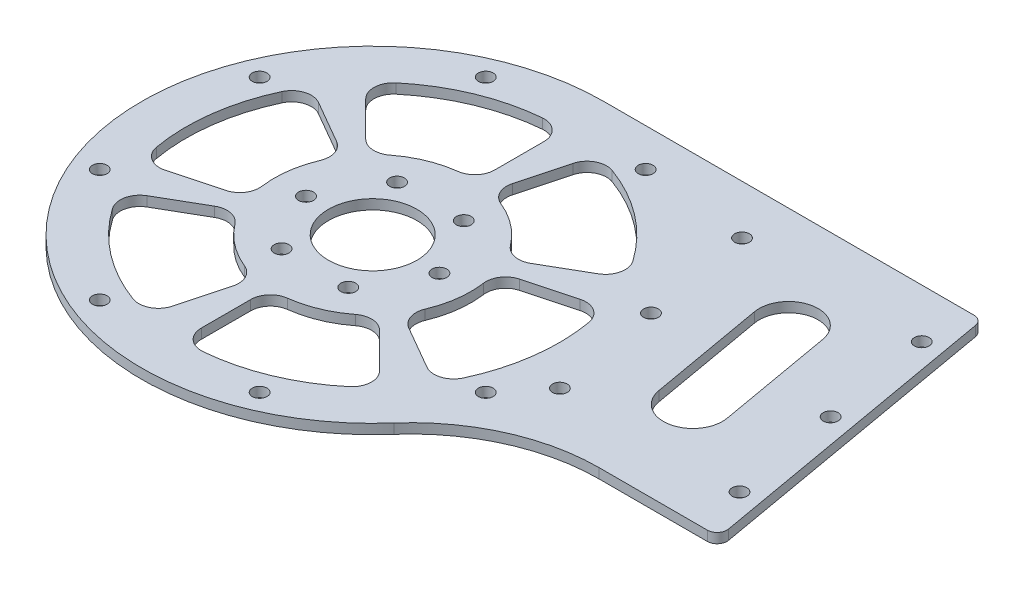
from build123d import *

# Parameters (mm, degrees)
SKETCH_1_R               = 1.5
SKETCH_1_R_2             = 9
EXTRUDE_1_DEPTH          = 2
CUT_EXTRUDE_1_DEPTH      = 100.85333965
CUT_EXTRUDE_1_DEPTH_BACK = 100.85333965
SKETCH_2_R               = 1.5
CUT_EXTRUDE_2_DEPTH      = 100.85333965
CUT_EXTRUDE_2_DEPTH_BACK = 100.85333965


with BuildPart() as part:
    # 草图1 → 凸台-拉伸1 (new body)
    with BuildSketch(Plane(origin=(0, 0, 0), x_dir=(1, 0, 0), z_dir=(0, 1, 0))):
        with BuildLine():
            Line((0, 47), (75.321800738, 47))
            ThreePointArc((75.321800738, 47), (76.607375957, 46.532088886), (77.291416244, 45.347296355))
            Line((77.291416244, 45.347296355), (88.047362067, -15.652703645))
            ThreePointArc((88.047362067, -15.652703645), (87.609835447, -17.285575219), (86.077746561, -18))
            Line((86.077746561, -18), (64.077746561, -18))
            ThreePointArc((64.077746561, -18), (48.289235397, -21.406433974), (35.309770387, -31.019673035))
            ThreePointArc((35.309770387, -31.019673035), (-42.818948099, -19.378794691), (0, 47))
        make_face()
        with Locations(Location((-16.264045876, 39.264880132, 0), (0, 0, 270))):
            Circle(SKETCH_1_R, mode=Mode.SUBTRACT)
        with Locations(Location((16.264045876, 39.264880132, 0), (0, 0, 270))):
            Circle(SKETCH_1_R, mode=Mode.SUBTRACT)
        with Locations(Location((39.264880132, -16.264045876, 0), (0, 0, 270))):
            Circle(SKETCH_1_R, mode=Mode.SUBTRACT)
        with Locations(Location((16.264045876, -39.264880132, 0), (0, 0, 270))):
            Circle(SKETCH_1_R, mode=Mode.SUBTRACT)
        with Locations(Location((-16.264045876, -39.264880132, 0), (0, 0, 270))):
            Circle(SKETCH_1_R, mode=Mode.SUBTRACT)
        with Locations(Location((-39.264880132, -16.264045876, 0), (0, 0, 270))):
            Circle(SKETCH_1_R, mode=Mode.SUBTRACT)
        with Locations(Location((-39.264880132, 16.264045876, 0), (0, 0, 270))):
            Circle(SKETCH_1_R, mode=Mode.SUBTRACT)
        with Locations(Location((0, 0, 0), (0, 0, 270))):
            Circle(SKETCH_1_R_2, mode=Mode.SUBTRACT)
        with Locations(Location((-6.783865663, 11.75, 0), (0, 0, 270))):
            Circle(SKETCH_1_R, mode=Mode.SUBTRACT)
        with Locations(Location((6.783865663, 11.75, 0), (0, 0, 270))):
            Circle(SKETCH_1_R, mode=Mode.SUBTRACT)
        with Locations(Location((13.567731326, 0, 0), (0, 0, 270))):
            Circle(SKETCH_1_R, mode=Mode.SUBTRACT)
        with Locations(Location((6.783865663, -11.75, 0), (0, 0, 270))):
            Circle(SKETCH_1_R, mode=Mode.SUBTRACT)
        with Locations(Location((-6.783865663, -11.75, 0), (0, 0, 270))):
            Circle(SKETCH_1_R, mode=Mode.SUBTRACT)
        with Locations(Location((-13.567731326, 0, 0), (0, 0, 270))):
            Circle(SKETCH_1_R, mode=Mode.SUBTRACT)
    extrude(amount=EXTRUDE_1_DEPTH)

    # 草图2 → 切除-拉伸1 (cut, two sides: drawn at the far end of the back side and taken through both)
    with BuildSketch(Plane(origin=(0, 2, 0), x_dir=(1, 0, 0), z_dir=(0, 1, 0)).offset(-CUT_EXTRUDE_1_DEPTH_BACK)):
        with Locations(Location((74.70156336, 37, 0), (0, 0, 270))):
            Circle(SKETCH_2_R)
        with Locations(Location((78.668920425, 14.5, 0), (0, 0, 270))):
            Circle(SKETCH_2_R)
        with Locations(Location((82.636277491, -8, 0), (0, 0, 270))):
            Circle(SKETCH_2_R)
        with Locations(Location((38.146205332, 37, 0), (0, 0, 270))):
            Circle(SKETCH_2_R)
        with Locations(Location((46.080919464, -8, 0), (0, 0, 270))):
            Circle(SKETCH_2_R)
        with Locations(Location((42.113562398, 14.5, 0), (0, 0, 270))):
            Circle(SKETCH_2_R)
        with BuildLine():
            Line((64.216309798, 27.359582102), (68.383866062, 3.72419603))
            ThreePointArc((68.383866062, 3.72419603), (63.51690861, -3.226539554), (56.566173025, 1.640417898))
            Line((56.566173025, 1.640417898), (52.398616761, 25.27580397))
            ThreePointArc((52.398616761, 25.27580397), (57.265574214, 32.226539554), (64.216309798, 27.359582102))
        make_face()
    extrude(amount=CUT_EXTRUDE_1_DEPTH + CUT_EXTRUDE_1_DEPTH_BACK, mode=Mode.SUBTRACT)

    # 草图3 → 切除-拉伸2 (cut, two sides: drawn at the far end of the back side and taken through both)
    with BuildSketch(Plane.XZ.offset(-CUT_EXTRUDE_2_DEPTH_BACK)):
        with BuildLine():
            ThreePointArc((13.035455865, -35.694213682), (23.132934302, -30.147426931), (31.104138605, -21.829625778))
            ThreePointArc((31.104138605, -21.829625778), (31.73567133, -18.668128181), (29.830018752, -16.067668818))
            Line((29.830018752, -16.067668818), (21.121590627, -11.039855496))
            ThreePointArc((21.121590627, -11.039855496), (18.33030278, -10.583005244), (15.934658856, -12.086630926))
            ThreePointArc((15.934658856, -12.086630926), (12.17522858, -15.867066806), (7.550595775, -18.519948797))
            ThreePointArc((7.550595775, -18.519948797), (5.478166623, -20.44479617), (5.197011625, -23.259214737))
            Line((5.197011625, -23.259214737), (7.799599311, -32.972204212))
            ThreePointArc((7.799599311, -32.972204212), (9.818230989, -35.485971662), (13.035455865, -35.694213682))
        make_face()
        with BuildLine():
            ThreePointArc((37.429823749, -6.558070912), (37.674904732, 4.959995304), (34.457079782, 16.022161306))
            ThreePointArc((34.457079782, 16.022161306), (32.03490891, 18.149833488), (28.830018752, 17.799719626))
            Line((28.830018752, 17.799719626), (20.121590627, 12.771906304))
            ThreePointArc((20.121590627, 12.771906304), (18.33030278, 10.583005244), (18.434658856, 7.756503907))
            ThreePointArc((18.434658856, 7.756503907), (19.828897227, 2.610523844), (19.814044022, -2.720966644))
            ThreePointArc((19.814044022, -2.720966644), (20.44479617, -5.478166623), (22.741576647, -7.128863277))
            Line((22.741576647, -7.128863277), (32.454566122, -9.731450963))
            ThreePointArc((32.454566122, -9.731450963), (35.640868431, -9.240148374), (37.429823749, -6.558070912))
        make_face()
        with BuildLine():
            ThreePointArc((24.394367884, 29.13614277), (14.54197043, 35.107422235), (3.352941176, 37.851787084))
            ThreePointArc((3.352941176, 37.851787084), (0.29923758, 36.817961668), (-1, 33.867388444))
            Line((-1, 33.867388444), (-1, 23.8117618))
            ThreePointArc((-1, 23.8117618), (0, 21.166010489), (2.5, 19.843134833))
            ThreePointArc((2.5, 19.843134833), (7.653668647, 18.47759065), (12.263448247, 15.798982153))
            ThreePointArc((12.263448247, 15.798982153), (14.966629547, 14.966629547), (17.544565022, 16.130351459))
            Line((17.544565022, 16.130351459), (24.654966811, 23.240753248))
            ThreePointArc((24.654966811, 23.240753248), (25.822637443, 26.245823287), (24.394367884, 29.13614277))
        make_face()
        with BuildLine():
            ThreePointArc((-13.035455865, 35.694213682), (-23.132934302, 30.147426931), (-31.104138605, 21.829625778))
            ThreePointArc((-31.104138605, 21.829625778), (-31.73567133, 18.668128181), (-29.830018752, 16.067668818))
            Line((-29.830018752, 16.067668818), (-21.121590627, 11.039855496))
            ThreePointArc((-21.121590627, 11.039855496), (-18.33030278, 10.583005244), (-15.934658856, 12.086630926))
            ThreePointArc((-15.934658856, 12.086630926), (-12.17522858, 15.867066806), (-7.550595775, 18.519948797))
            ThreePointArc((-7.550595775, 18.519948797), (-5.478166623, 20.44479617), (-5.197011625, 23.259214737))
            Line((-5.197011625, 23.259214737), (-7.799599311, 32.972204212))
            ThreePointArc((-7.799599311, 32.972204212), (-9.818230989, 35.485971662), (-13.035455865, 35.694213682))
        make_face()
        with BuildLine():
            ThreePointArc((-37.429823749, 6.558070912), (-37.674904732, -4.959995304), (-34.457079782, -16.022161306))
            ThreePointArc((-34.457079782, -16.022161306), (-32.03490891, -18.149833488), (-28.830018752, -17.799719626))
            Line((-28.830018752, -17.799719626), (-20.121590627, -12.771906304))
            ThreePointArc((-20.121590627, -12.771906304), (-18.33030278, -10.583005244), (-18.434658856, -7.756503907))
            ThreePointArc((-18.434658856, -7.756503907), (-19.828897227, -2.610523844), (-19.814044022, 2.720966644))
            ThreePointArc((-19.814044022, 2.720966644), (-20.44479617, 5.478166623), (-22.741576647, 7.128863277))
            Line((-22.741576647, 7.128863277), (-32.454566122, 9.731450963))
            ThreePointArc((-32.454566122, 9.731450963), (-35.640868431, 9.240148374), (-37.429823749, 6.558070912))
        make_face()
        with BuildLine():
            ThreePointArc((-24.394367884, -29.13614277), (-14.54197043, -35.107422235), (-3.352941176, -37.851787084))
            ThreePointArc((-3.352941176, -37.851787084), (-0.29923758, -36.817961668), (1, -33.867388444))
            Line((1, -33.867388444), (1, -23.8117618))
            ThreePointArc((1, -23.8117618), (0, -21.166010489), (-2.5, -19.843134833))
            ThreePointArc((-2.5, -19.843134833), (-7.653668647, -18.47759065), (-12.263448247, -15.798982153))
            ThreePointArc((-12.263448247, -15.798982153), (-14.966629547, -14.966629547), (-17.544565022, -16.130351459))
            Line((-17.544565022, -16.130351459), (-24.654966811, -23.240753248))
            ThreePointArc((-24.654966811, -23.240753248), (-25.822637443, -26.245823287), (-24.394367884, -29.13614277))
        make_face()
    extrude(amount=CUT_EXTRUDE_2_DEPTH + CUT_EXTRUDE_2_DEPTH_BACK, mode=Mode.SUBTRACT)


solid = part.part
